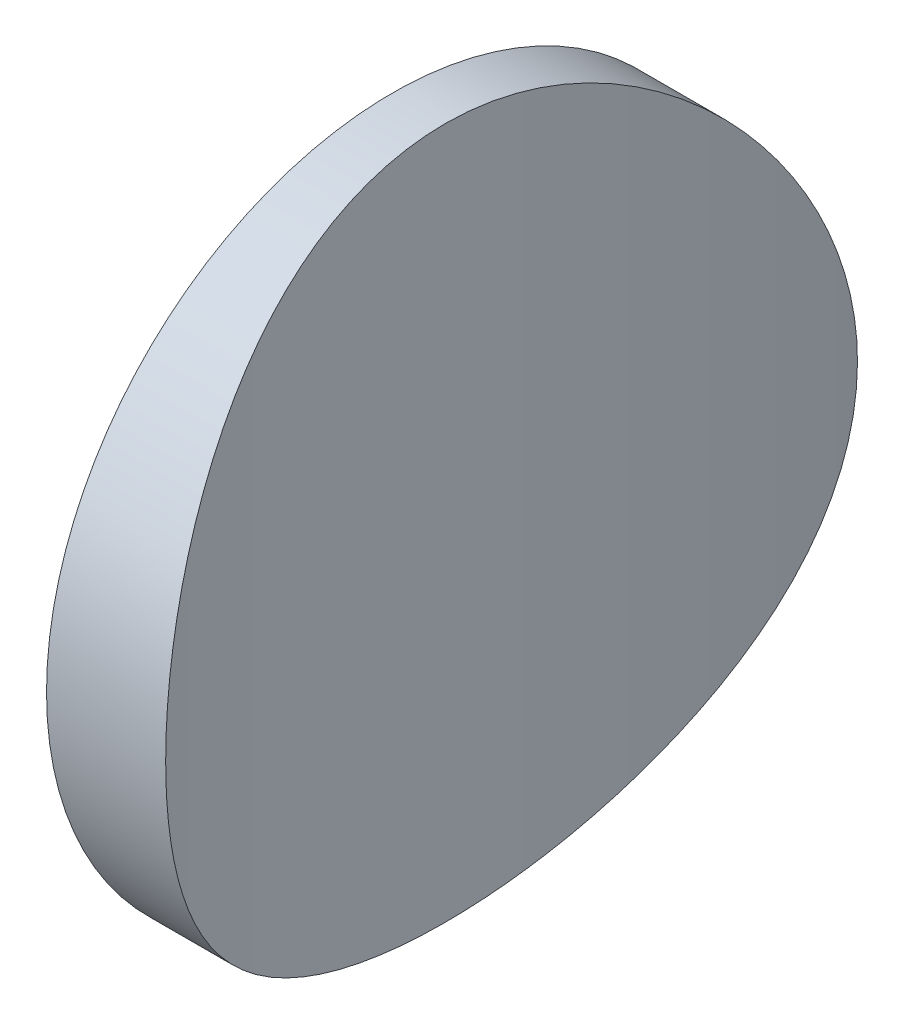
from build123d import *

# Parameters (mm, degrees)
SKETCH_1_R               = 85
EXTRUDE_1_DEPTH          = 50
CUT_EXTRUDE_1_DEPTH      = 131.192165663
CUT_EXTRUDE_1_DEPTH_BACK = 131.192165663
SKETCH_2_R               = 230


with BuildPart() as part:
    # Эскиз1 → Бобышка-Вытянуть1 (new body)
    with BuildSketch(Plane(origin=(0, 0, 0), x_dir=(0, 0, -1), z_dir=(1, 0, 0))):
        Circle(SKETCH_1_R)
    extrude(amount=EXTRUDE_1_DEPTH)

    # Эскиз2 → Вырез-Вытянуть1 (cut, two sides: drawn at the far end of the back side and taken through both)
    with BuildSketch(Plane(origin=(0, 0, 0), x_dir=(1, 0, 0), z_dir=(0, 1, 0)).offset(-CUT_EXTRUDE_1_DEPTH_BACK)):
        with Locations((243, 0)):
            Circle(SKETCH_2_R)
    extrude(amount=CUT_EXTRUDE_1_DEPTH + CUT_EXTRUDE_1_DEPTH_BACK, mode=Mode.SUBTRACT)


solid = part.part
